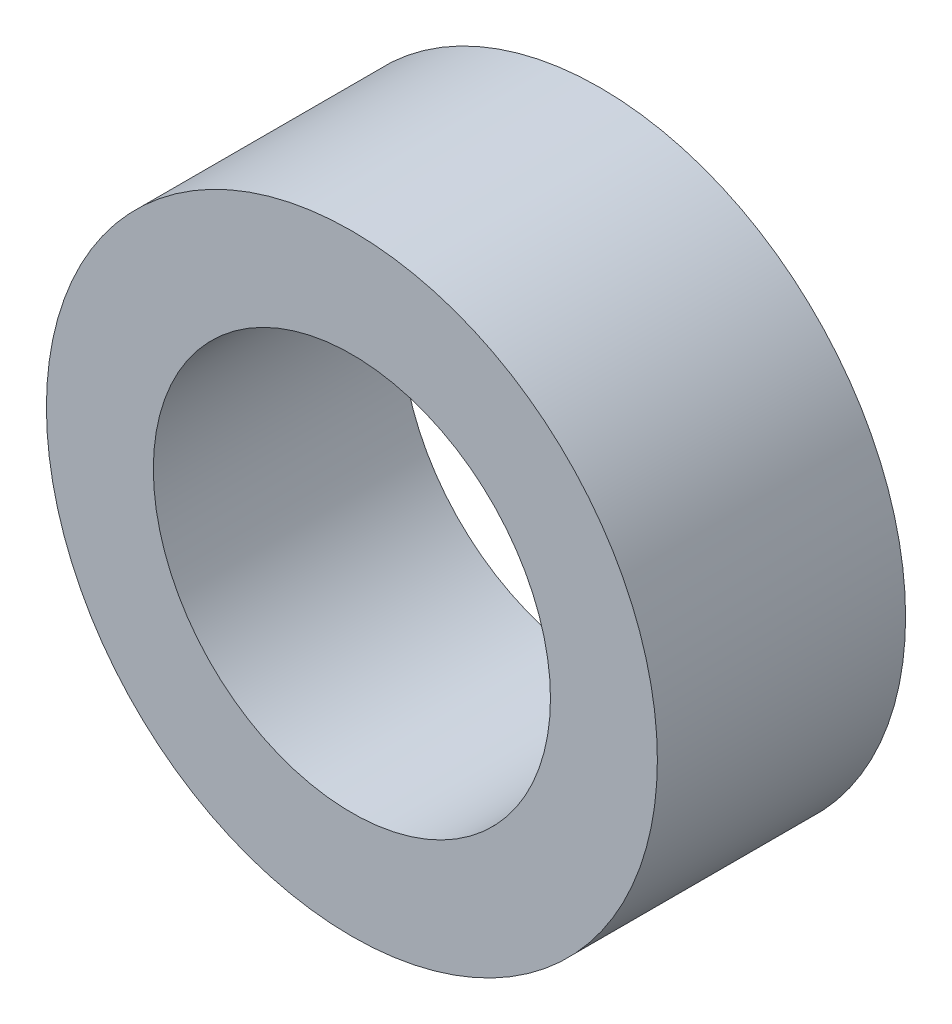
from build123d import *

# Parameters (mm, degrees)
SKETCH_1_R      = 4
SKETCH_1_R_2    = 2.6
EXTRUDE_1_DEPTH = 3.25


with BuildPart() as part:
    # 草图1 → 凸台-拉伸1 (new body)
    with BuildSketch(Plane.XY):
        with Locations(Location((0, 0, 0), (0, 0, 180))):
            Circle(SKETCH_1_R)
        with Locations(Location((0, 0, 0), (0, 0, 180))):
            Circle(SKETCH_1_R_2, mode=Mode.SUBTRACT)
    extrude(amount=EXTRUDE_1_DEPTH)


solid = part.part
